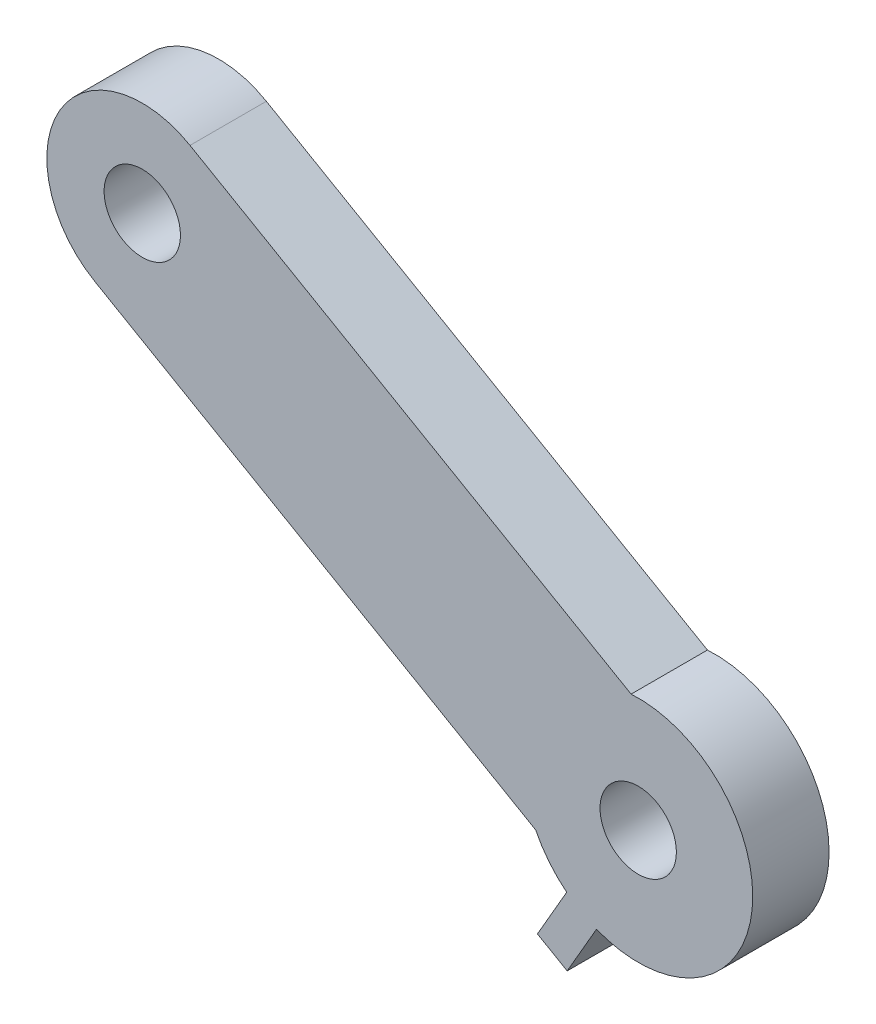
from build123d import *

# Parameters (mm, degrees)
ESQUISSE1_R        = 10
BOSS_EXTRU_1_DEPTH = 20


with BuildPart() as part:
    # Esquisse1 → Boss.-Extru.1 (new body)
    with BuildSketch(Plane.XY):
        with BuildLine():
            Line((-1.861405692, 29.942197128), (-117.403809643, 96.650635152))
            ThreePointArc((-117.403809643, 96.650635152), (-151.55444502, 87.500001112), (-142.40381098, 53.349365735))
            Line((-142.40381098, 53.349365735), (-26.861407029, -13.359072289))
            ThreePointArc((-26.861407029, -13.359072289), (-23.344702971, -18.842102939), (-18.727404267, -23.436815684))
            Line((-18.727404267, -23.436815684), (-26.397114317, -36.72114317))
            Line((-26.397114317, -36.72114317), (-18.602885683, -41.22114317))
            Line((-18.602885683, -41.22114317), (-10.933175633, -27.936815684))
            ThreePointArc((-10.933175633, -27.936815684), (29.638157143, -4.645389236), (-1.861405692, 29.942197128))
        make_face()
        with Locations((-129.903810312, 75.000000443)):
            Circle(ESQUISSE1_R, mode=Mode.SUBTRACT)
        Circle(ESQUISSE1_R, mode=Mode.SUBTRACT)
    extrude(amount=BOSS_EXTRU_1_DEPTH)


solid = part.part
